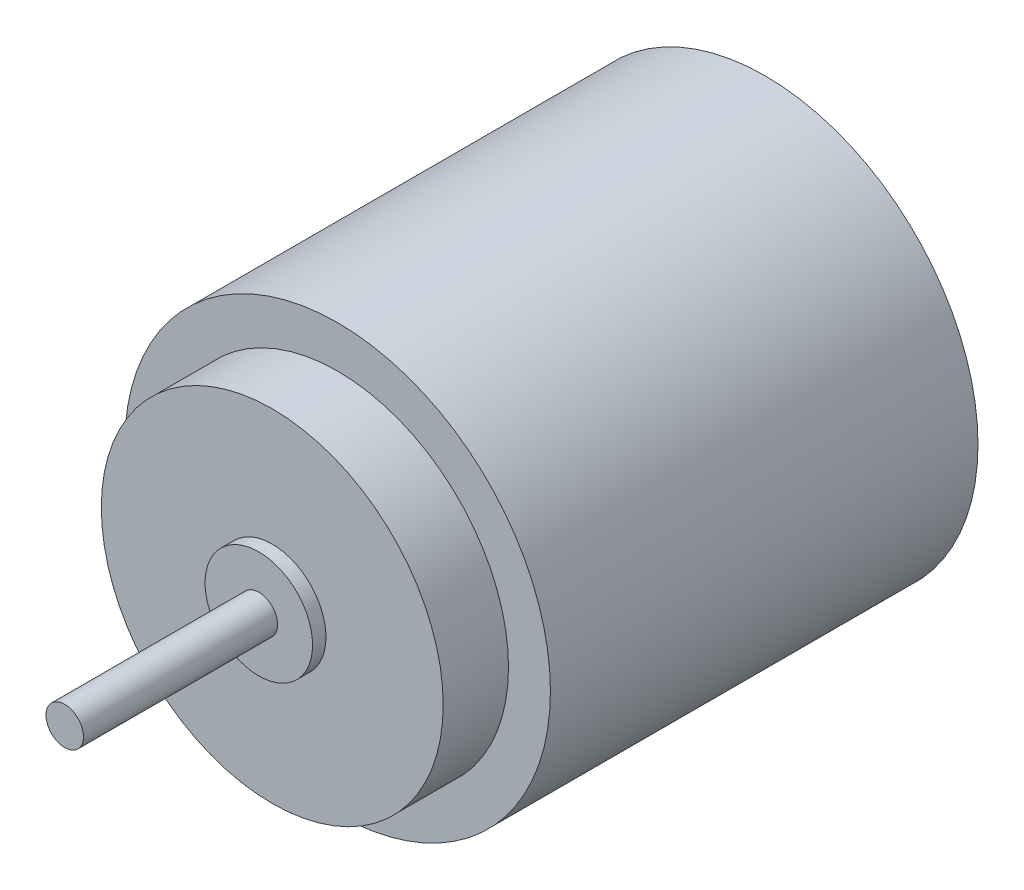
from build123d import *

# Parameters (mm, degrees)
SKETCH1_R           = 11.6713
BOSS_EXTRUDE1_DEPTH = 23.4442
SKETCH4_R           = 9.3726
BOSS_EXTRUDE3_DEPTH = 3.5814
SKETCH5_R           = 2.9464
BOSS_EXTRUDE4_DEPTH = 0.7366
SKETCH2_R           = 1.0287
BOSS_EXTRUDE2_DEPTH = 10.6426


with BuildPart() as part:
    # Sketch1 → Boss-Extrude1 (new body)
    with BuildSketch(Plane.XY):
        Circle(SKETCH1_R)
    extrude(amount=BOSS_EXTRUDE1_DEPTH)

    # Sketch4 → Boss-Extrude3 (add)
    with BuildSketch(Plane.XY.offset(23.4442)):
        Circle(SKETCH4_R)
    extrude(amount=BOSS_EXTRUDE3_DEPTH)

    # Sketch5 → Boss-Extrude4 (add)
    with BuildSketch(Plane.XY.offset(27.0256)):
        Circle(SKETCH5_R)
    extrude(amount=BOSS_EXTRUDE4_DEPTH)

    # Sketch2 → Boss-Extrude2 (add)
    with BuildSketch(Plane.XY.offset(27.7622)):
        Circle(SKETCH2_R)
    extrude(amount=BOSS_EXTRUDE2_DEPTH)


solid = part.part
